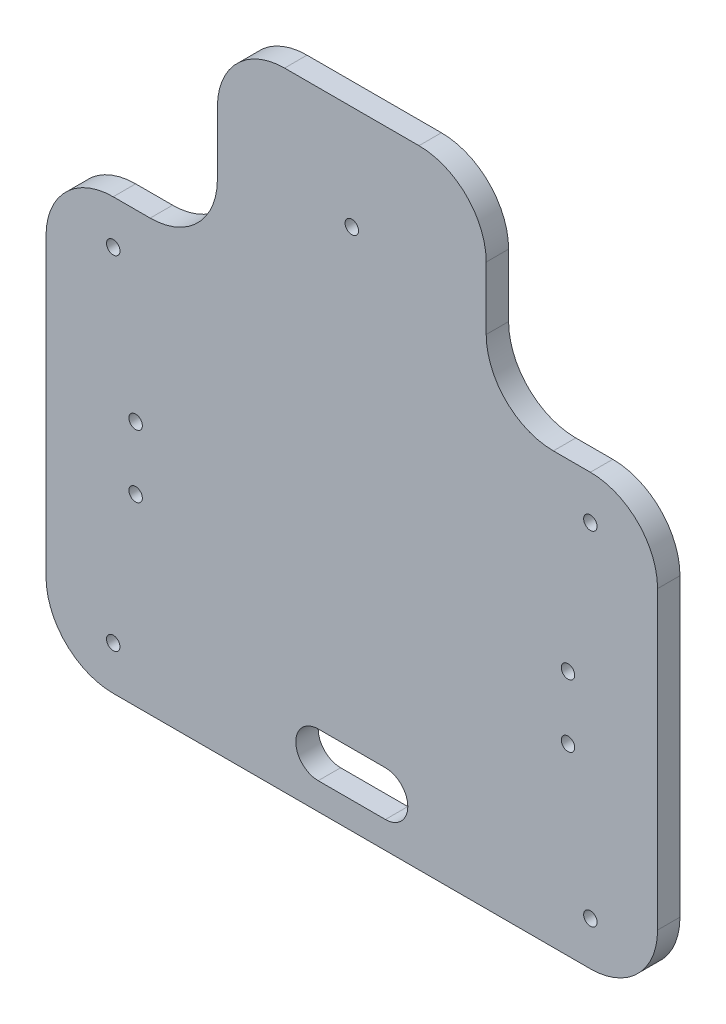
from build123d import *

# Parameters (mm, degrees)
SKETCH2_R           = 1.5
BOSS_EXTRUDE1_DEPTH = 5


with BuildPart() as part:
    # Sketch2 → Boss-Extrude1 (new body)
    with BuildSketch(Plane.XY):
        with BuildLine():
            Line((807.944636851, 1128.1431403), (807.944636851, 1114.1431403))
            ThreePointArc((807.944636851, 1114.1431403), (803.551238569, 1103.536538582), (792.944636851, 1099.1431403))
            Line((792.944636851, 1099.1431403), (784.694636851, 1099.1431403))
            ThreePointArc((784.694636851, 1099.1431403), (774.088035133, 1094.749742018), (769.694636851, 1084.1431403))
            Line((769.694636851, 1084.1431403), (769.694636851, 1018.1431403))
            ThreePointArc((769.694636851, 1018.1431403), (774.088035133, 1007.536538582), (784.694636851, 1003.1431403))
            Line((784.694636851, 1003.1431403), (891.194636851, 1003.1431403))
            ThreePointArc((891.194636851, 1003.1431403), (901.801238569, 1007.536538582), (906.194636851, 1018.1431403))
            Line((906.194636851, 1018.1431403), (906.194636851, 1084.1431403))
            ThreePointArc((906.194636851, 1084.1431403), (901.801238569, 1094.749742018), (891.194636851, 1099.1431403))
            Line((891.194636851, 1099.1431403), (882.944636851, 1099.1431403))
            ThreePointArc((882.944636851, 1099.1431403), (872.338035133, 1103.536538582), (867.944636851, 1114.1431403))
            Line((867.944636851, 1114.1431403), (867.944636851, 1128.1431403))
            ThreePointArc((867.944636851, 1128.1431403), (863.551238569, 1138.749742018), (852.944636851, 1143.1431403))
            Line((852.944636851, 1143.1431403), (822.944636851, 1143.1431403))
            ThreePointArc((822.944636851, 1143.1431403), (812.338035133, 1138.749742018), (807.944636851, 1128.1431403))
        make_face()
        with Locations((837.944636851, 1119.927749991)):
            Circle(SKETCH2_R, mode=Mode.SUBTRACT)
        with Locations((784.694636851, 1012.8931403)):
            Circle(SKETCH2_R, mode=Mode.SUBTRACT)
        with Locations((886.194636851, 1044.1431403)):
            Circle(SKETCH2_R, mode=Mode.SUBTRACT)
        with Locations((886.194636851, 1058.1431403)):
            Circle(SKETCH2_R, mode=Mode.SUBTRACT)
        with Locations((789.694636851, 1044.1431403)):
            Circle(SKETCH2_R, mode=Mode.SUBTRACT)
        with Locations((789.694636851, 1058.1431403)):
            Circle(SKETCH2_R, mode=Mode.SUBTRACT)
        with Locations((784.694636851, 1089.3931403)):
            Circle(SKETCH2_R, mode=Mode.SUBTRACT)
        with Locations((891.194636851, 1089.3931403)):
            Circle(SKETCH2_R, mode=Mode.SUBTRACT)
        with Locations((891.194636851, 1012.8931403)):
            Circle(SKETCH2_R, mode=Mode.SUBTRACT)
        with BuildLine():
            Line((845.444636851, 1009.1431403), (830.444636851, 1009.1431403))
            ThreePointArc((830.444636851, 1009.1431403), (825.444636851, 1014.1431403), (830.444636851, 1019.1431403))
            Line((830.444636851, 1019.1431403), (845.444636851, 1019.1431403))
            ThreePointArc((845.444636851, 1019.1431403), (850.444636851, 1014.1431403), (845.444636851, 1009.1431403))
        make_face(mode=Mode.SUBTRACT)
    extrude(amount=BOSS_EXTRUDE1_DEPTH)


solid = part.part
